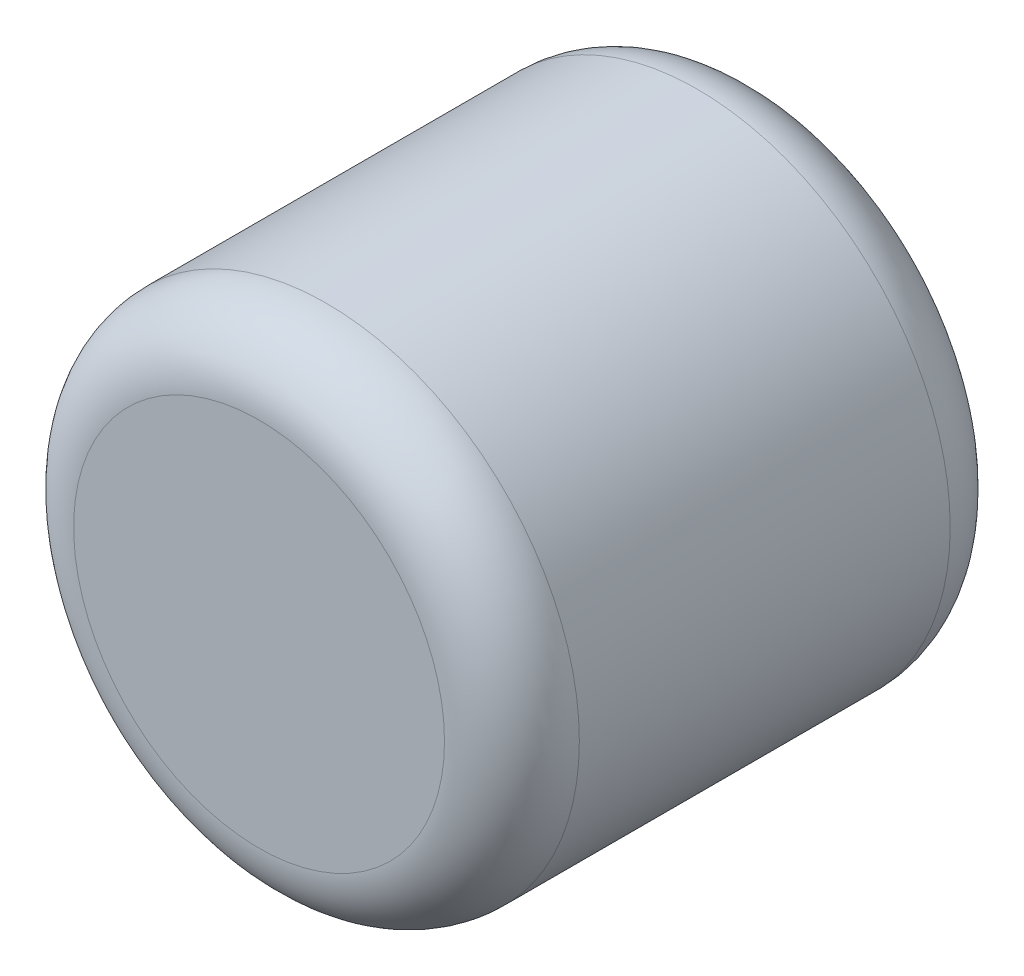
from build123d import *

# Parameters (mm, degrees)
SKETCH1_R           = 15
BOSS_EXTRUDE1_DEPTH = 30
FILLET1_R           = 4
FILLET2_R           = 4


with BuildPart() as part:
    # Sketch1 → Boss-Extrude1 (new body)
    with BuildSketch(Plane.XY):
        Circle(SKETCH1_R)
    extrude(amount=BOSS_EXTRUDE1_DEPTH)

    # Fillet1
    fillet1_edges = [part.edges().sort_by_distance(p)[0] for p in [
        (-15, 0, 30),
    ]]
    fillet(fillet1_edges, radius=FILLET1_R)

    # Fillet2
    fillet2_edges = [part.edges().sort_by_distance(p)[0] for p in [
        (-15, 0, 0),
    ]]
    fillet(fillet2_edges, radius=FILLET2_R)


solid = part.part
